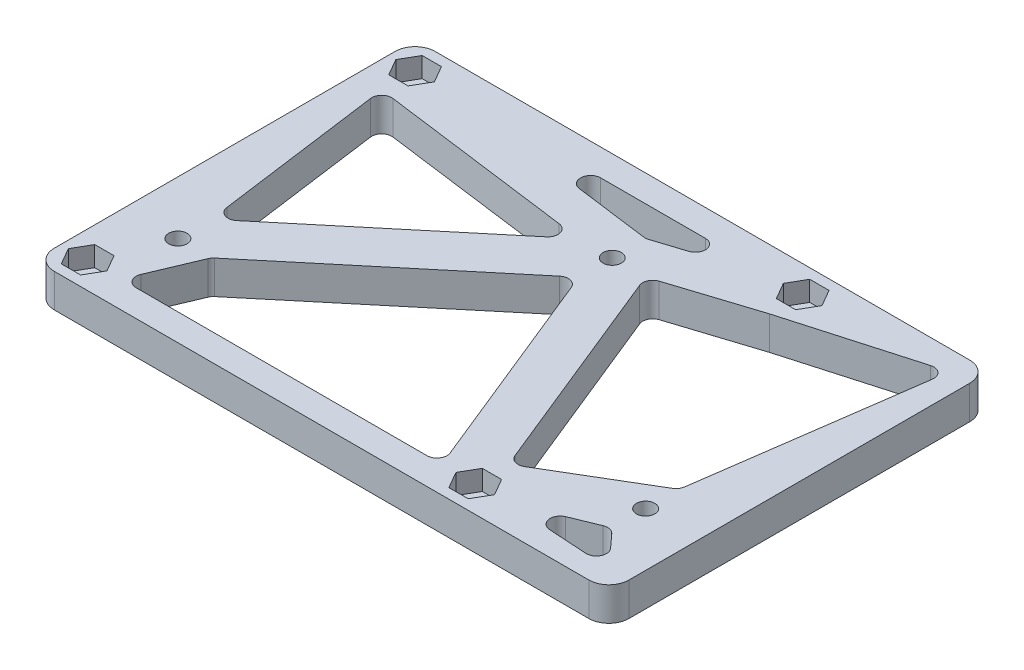
from build123d import *

# Parameters (mm, degrees)
SKETCH1_R           = 1.375
BOSS_EXTRUDE1_DEPTH = 5
CUT_EXTRUDE1_DEPTH  = 3
SKETCH3_R           = 2.5
CUT_EXTRUDE2_DEPTH  = 2.5


with BuildPart() as part:
    # Sketch1 → Boss-Extrude1 (new body)
    with BuildSketch(Plane(origin=(0, 0, 0), x_dir=(1, 0, 0), z_dir=(0, 1, 0))):
        with BuildLine():
            Line((-40, -28.5), (40, -28.5))
            ThreePointArc((40, -28.5), (42.121320344, -27.621320344), (43, -25.5))
            Line((43, -25.5), (43, 25.5))
            ThreePointArc((43, 25.5), (42.121320344, 27.621320344), (40, 28.5))
            Line((40, 28.5), (-40, 28.5))
            ThreePointArc((-40, 28.5), (-42.121320344, 27.621320344), (-43, 25.5))
            Line((-43, 25.5), (-43, -25.5))
            ThreePointArc((-43, -25.5), (-42.121320344, -27.621320344), (-40, -28.5))
        make_face()
        with Locations(Location((0, 15, 0), (0, 0, 270))):
            Circle(SKETCH1_R, mode=Mode.SUBTRACT)
        with Locations(Location((-35, -15, 0), (0, 0, 270))):
            Circle(SKETCH1_R, mode=Mode.SUBTRACT)
        with Locations(Location((35, -15, 0), (0, 0, 270))):
            Circle(SKETCH1_R, mode=Mode.SUBTRACT)
        with Locations(Location((-39, 24.5, 0), (0, 0, 270))):
            Circle(SKETCH1_R, mode=Mode.SUBTRACT)
        with Locations(Location((19, 24.5, 0), (0, 0, 270))):
            Circle(SKETCH1_R, mode=Mode.SUBTRACT)
        with Locations(Location((19, -24.5, 0), (0, 0, 270))):
            Circle(SKETCH1_R, mode=Mode.SUBTRACT)
        with Locations(Location((-39, -24.5, 0), (0, 0, 270))):
            Circle(SKETCH1_R, mode=Mode.SUBTRACT)
        with BuildLine():
            Line((-37.052885882, 19.24229372), (-8.391974967, 15.448937863))
            ThreePointArc((-8.391974967, 15.448937863), (-7.147859594, 14.378709263), (-7.628511446, 12.809573795))
            Line((-7.628511446, 12.809573795), (-32.917550489, -8.264625407))
            ThreePointArc((-32.917550489, -8.264625407), (-34.421149889, -8.510435231), (-35.364225221, -7.313838997))
            Line((-35.364225221, -7.313838997), (-38.736097093, 17.553716061))
            ThreePointArc((-38.736097093, 17.553716061), (-38.312045905, 18.814232283), (-37.052885882, 19.24229372))
        make_face(mode=Mode.SUBTRACT)
        with BuildLine():
            Line((-1.577880073, 8.685099939), (-29.719509612, -14.76625801))
            ThreePointArc((-29.719509612, -14.76625801), (-29.964799607, -15.026060273), (-30.141686076, -15.33650443))
            Line((-30.141686076, -15.33650443), (-33.123332421, -22.4179145))
            ThreePointArc((-33.123332421, -22.4179145), (-32.990504952, -23.829720359), (-31.740879358, -24.5))
            Line((-31.740879358, -24.5), (11.772505288, -24.5))
            ThreePointArc((11.772505288, -24.5), (13.016699367, -23.83784312), (13.162424553, -22.435974791))
            Line((13.162424553, -22.435974791), (0.772315791, 8.096793229))
            ThreePointArc((0.772315791, 8.096793229), (-0.253358499, 8.987871314), (-1.577880073, 8.685099939))
        make_face(mode=Mode.SUBTRACT)
        with BuildLine():
            Line((-11.234499574, 24.5), (4.43151961, 24.5))
            ThreePointArc((4.43151961, 24.5), (5.913421136, 23.232309855), (4.890533381, 21.571957158))
            Line((4.890533381, 21.571957158), (0.321277785, 20.10326786))
            ThreePointArc((0.321277785, 20.10326786), (-0.003358772, 20.037341905), (-0.334549064, 20.044278553))
            Line((-0.334549064, 20.044278553), (-11.431312652, 21.512967851))
            ThreePointArc((-11.431312652, 21.512967851), (-12.7312541, 23.098619918), (-11.234499574, 24.5))
        make_face(mode=Mode.SUBTRACT)
        with BuildLine():
            Line((6.538594674, 15.494548288), (19, 19.5))
            Line((19, 19.5), (37.780665263, 24.865904361))
            ThreePointArc((37.780665263, 24.865904361), (39.177543611, 24.555066868), (39.678086712, 23.214415657))
            Line((39.678086712, 23.214415657), (35.10041997, -9.287018213))
            ThreePointArc((35.10041997, -9.287018213), (34.8636112, -9.909181999), (34.380888344, -10.367597546))
            Line((34.380888344, -10.367597546), (20.4998423, -18.609468634))
            ThreePointArc((20.4998423, -18.609468634), (19.255432614, -18.741284405), (18.344114904, -17.883711727))
            Line((18.344114904, -17.883711727), (5.607689179, 13.502480237))
            ThreePointArc((5.607689179, 13.502480237), (5.638666899, 14.70154708), (6.538594674, 15.494548288))
        make_face(mode=Mode.SUBTRACT)
        with BuildLine():
            Line((30.055567192, -22.022722512), (34.028332843, -20.397500201))
            ThreePointArc((34.028332843, -20.397500201), (34.927038281, -20.322741568), (35.706192222, -20.776811444))
            Line((35.706192222, -20.776811444), (37.51199479, -22.763194269))
            ThreePointArc((37.51199479, -22.763194269), (37.754252366, -24.421543548), (36.308517251, -25.269282328))
            Line((36.308517251, -25.269282328), (30.529949031, -24.908121814))
            ThreePointArc((30.529949031, -24.908121814), (29.14338695, -23.654387623), (30.055567192, -22.022722512))
        make_face(mode=Mode.SUBTRACT)
    extrude(amount=BOSS_EXTRUDE1_DEPTH)

    # Sketch2 → Cut-Extrude1 (cut)
    with BuildSketch(Plane(origin=(0, 5, 0), x_dir=(1, 0, 0), z_dir=(0, 1, 0))):
        Polygon((-36.113248654, 24.5), (-37.556624327, 27), (-40.443375673, 27), (-41.886751346, 24.5), (-40.443375673, 22), (-37.556624327, 22), align=None)
        Polygon((20.443375673, 27), (17.556624327, 27), (16.113248654, 24.5), (17.556624327, 22), (20.443375673, 22), (21.886751346, 24.5), align=None)
        Polygon((20.443375673, -22), (17.556624327, -22), (16.113248654, -24.5), (17.556624327, -27), (20.443375673, -27), (21.886751346, -24.5), align=None)
        Polygon((-36.113248654, -24.5), (-37.556624327, -22), (-40.443375673, -22), (-41.886751346, -24.5), (-40.443375673, -27), (-37.556624327, -27), align=None)
    extrude(amount=-CUT_EXTRUDE1_DEPTH, mode=Mode.SUBTRACT)

    # Sketch3 → Cut-Extrude2 (cut)
    with BuildSketch(Plane.XZ):
        with Locations(Location((-35, 15, 0), (0, 0, 270))):
            Circle(SKETCH3_R)
        with Locations(Location((35, 15, 0), (0, 0, 270))):
            Circle(SKETCH3_R)
        with Locations(Location((0, -15, 0), (0, 0, 270))):
            Circle(SKETCH3_R)
    extrude(amount=-CUT_EXTRUDE2_DEPTH, mode=Mode.SUBTRACT)


solid = part.part
